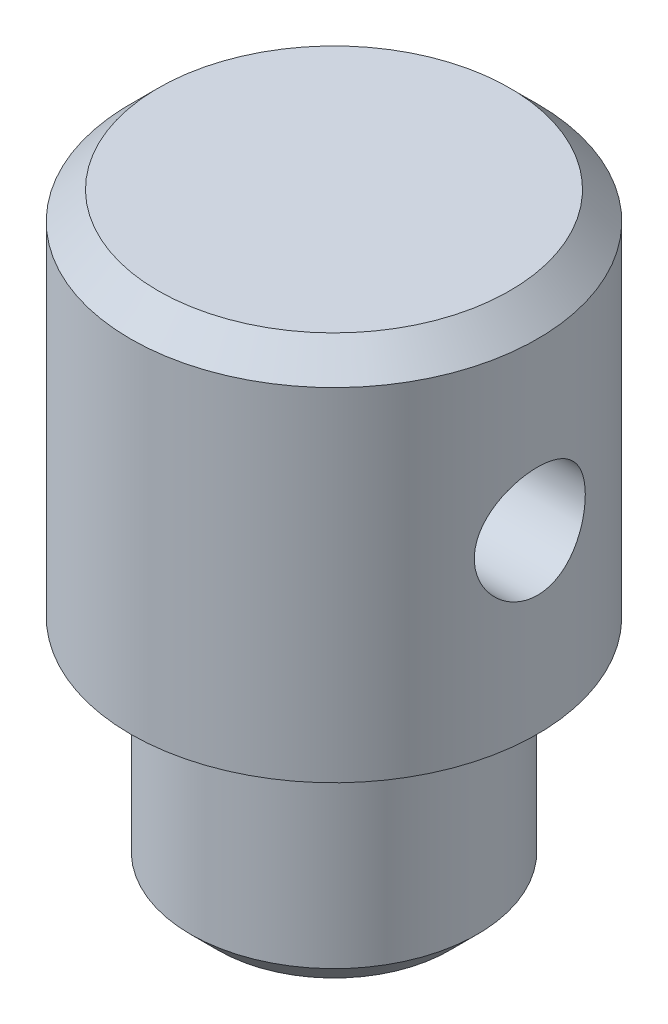
from build123d import *

# Parameters (mm, degrees)
F_18_0_1695_DIAMETER_HOLE1_D     = 4.3053
F_18_0_1695_DIAMETER_HOLE1_DEPTH = 11.176
F_18_0_1695_DIAMETER_HOLE1_TIP   = 1.293442612
SKETCH4_R                        = 1.524
CUT_EXTRUDE1_DEPTH               = 11.43
CHAMFER1_SIZE                    = 0.762


with BuildPart() as part:
    # Sketch1 → Revolve1 (revolve)
    with BuildSketch(Plane.XY, mode=Mode.PRIVATE) as revolve1_sk:
        Polygon((0, 0), (0, 16.51), (4.826, 16.51), (5.588, 15.748), (5.588, 6.35), (3.937, 6.35), (3.937, 0), align=None)
    revolve(revolve1_sk.sketch.rotate(Axis((0, 0, 0), (0, -1, 0)), 90), axis=Axis((0, 0, 0), (0, -1, 0)))

    # #18 (0.1695) Diameter Hole1
    with Locations(Plane.XZ):
        with Locations((0, 0)):
            Hole(F_18_0_1695_DIAMETER_HOLE1_D / 2, depth=F_18_0_1695_DIAMETER_HOLE1_DEPTH)
            with Locations((0, 0, -(F_18_0_1695_DIAMETER_HOLE1_DEPTH + F_18_0_1695_DIAMETER_HOLE1_TIP / 2))):  # 118° drill point
                Cone(0, F_18_0_1695_DIAMETER_HOLE1_D / 2, F_18_0_1695_DIAMETER_HOLE1_TIP, mode=Mode.SUBTRACT)

    # Sketch4 → Cut-Extrude1 (cut, symmetric)
    with BuildSketch(Plane(origin=(0, 0, 0), x_dir=(0, 0, -1), z_dir=(1, 0, 0))):
        with Locations((0, 11.176)):
            Circle(SKETCH4_R)
    extrude(amount=CUT_EXTRUDE1_DEPTH, both=True, mode=Mode.SUBTRACT)

    # Chamfer1
    chamfer1_edges = [part.edges().sort_by_distance(p)[0] for p in [
        (0, 0, -3.937),
    ]]
    chamfer(chamfer1_edges, length=CHAMFER1_SIZE)


solid = part.part
